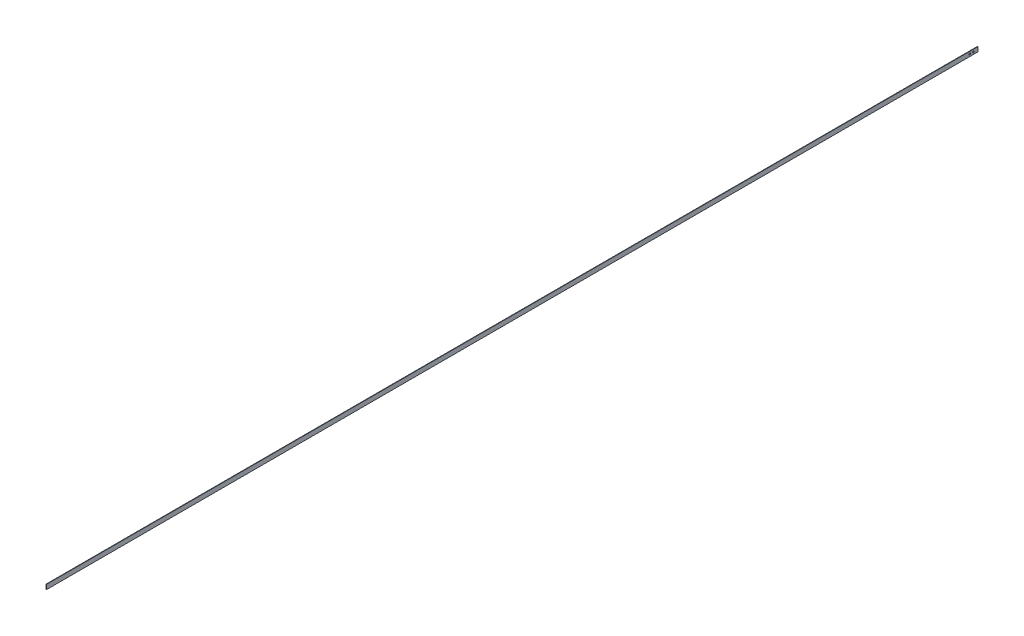
from build123d import *

# Parameters (mm, degrees)
SKETCH1_W                = 0.3
SKETCH1_H                = 3
BOSS_EXTRUDE1_DEPTH      = 610
F_1_0_1_DIAMETER_HOLE1_D = 1


with BuildPart() as part:
    # Sketch1 → Boss-Extrude1 (new body)
    with BuildSketch(Plane.XY):
        Rectangle(SKETCH1_W, SKETCH1_H)
    extrude(amount=BOSS_EXTRUDE1_DEPTH)

    # Ø1.0 (1) Diameter Hole1 (through all)
    with Locations(Plane(origin=(0.15, 0, 0), x_dir=(0, 0, -1), z_dir=(1, 0, 0))):
        with Locations((-5.5, 0), (-3, 0)):
            Hole(F_1_0_1_DIAMETER_HOLE1_D / 2)


solid = part.part
